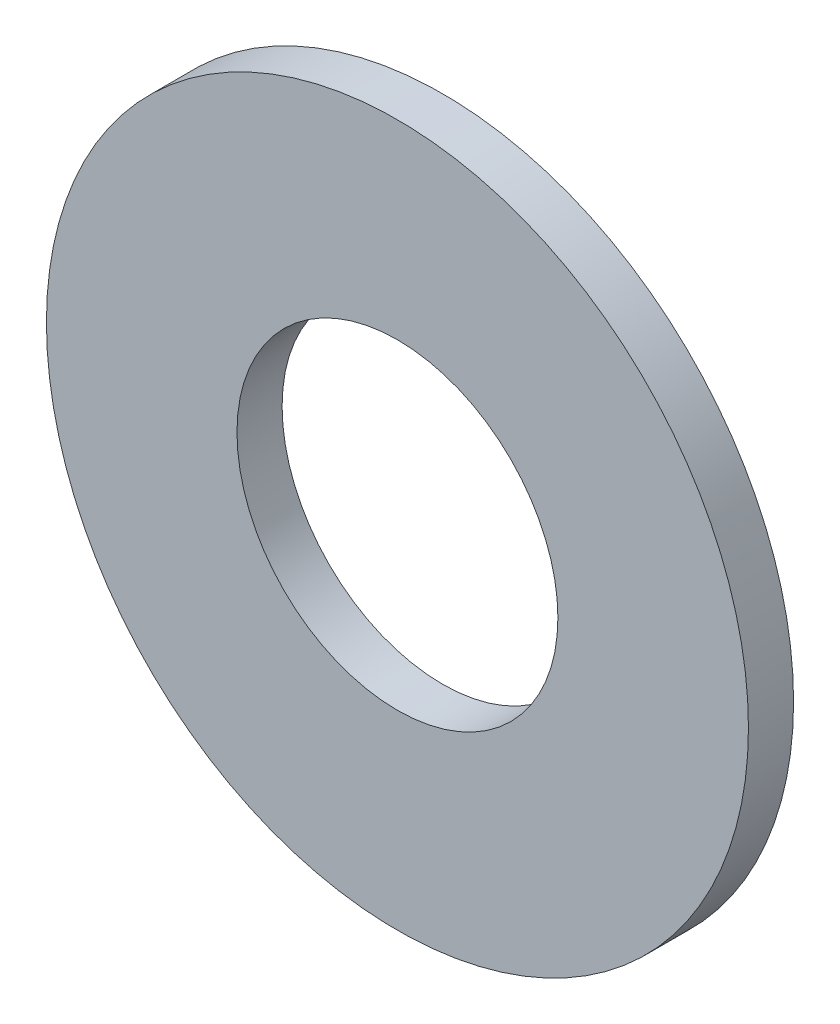
from build123d import *

# Parameters (mm, degrees)
SKETCH1_R           = 3.5
SKETCH1_R_2         = 1.6
BOSS_EXTRUDE1_DEPTH = 0.45


with BuildPart() as part:
    # Sketch1 → Boss-Extrude1 (new body)
    with BuildSketch(Plane.XY):
        Circle(SKETCH1_R)
        Circle(SKETCH1_R_2, mode=Mode.SUBTRACT)
    extrude(amount=BOSS_EXTRUDE1_DEPTH)


solid = part.part
